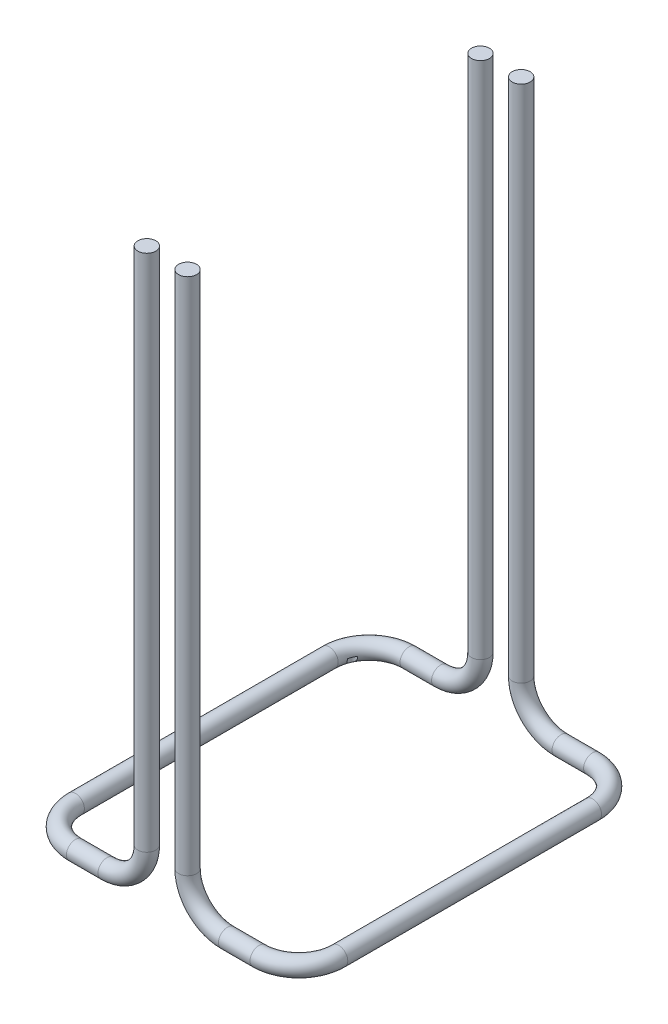
from build123d import *

# Parameters (mm, degrees)
SWEEP_1_PROFILE_R   = 11.25
SWEEP_2_PROFILE_R   = 11.25
SKETCH_35_R         = 5
CUT_EXTRUDE_1_DEPTH = 841.210963366


with BuildPart() as part:
    # 扫描1: sweep along a curve in space
    with BuildLine() as sweep_1_path:
        Line((25.5, 700.453465614, 0), (25.5, 50.453465614, 0))
        ThreePointArc((25.5, 50.453465614, 0), (40.144660941, 15.098126555, 0), (75.5, 0.453465614, 0))
        Line((75.5, 0.453465614, 0), (114.999376874, 0.453465614, 0))
        ThreePointArc((114.999376874, 0.453465614, 0), (150.354715934, 0.453465614, -14.644660941), (164.999376874, 0.453465614, -50))
        Line((164.999376874, 0.453465614, -50), (164.999376874, 0.453465614, -368))
        ThreePointArc((164.999376874, 0.453465614, -368), (150.354715934, 0.453465614, -403.355339059), (114.999376874, 0.453465614, -418))
        Line((114.999376874, 0.453465614, -418), (75.5, 0.453465614, -418))
        ThreePointArc((75.5, 0.453465614, -418), (40.144660941, 15.098126555, -418), (25.5, 50.453465614, -418))
        Line((25.5, 50.453465614, -418), (25.5, 700.453465614, -418))
    # 扫描1 profile (on start of the path) → 扫描1 (sweep)
    with BuildSketch(Plane(origin=(25.5, 700.453465614, 0), x_dir=(0, 0, -1), z_dir=(0, -1, 0))):
        Circle(SWEEP_1_PROFILE_R)
    sweep(path=sweep_1_path.line)


with BuildPart() as body_2:
    # 扫描2: sweep along a curve in space
    with BuildLine() as sweep_2_path:
        Line((-25.5, 50.453465614, -418), (-25.5, 700.453465614, -418))
        ThreePointArc((-25.5, 50.453465614, -418), (-40.144660941, 15.098126555, -418), (-75.5, 0.453465614, -418))
        Line((-114.999376874, 0.453465614, -418), (-75.5, 0.453465614, -418))
        ThreePointArc((-114.999376874, 0.453465614, -418), (-150.354715934, 0.453465614, -403.355339059), (-164.999376874, 0.453465614, -368))
        Line((-164.999376874, 0.453465614, -50), (-164.999376874, 0.453465614, -368))
        ThreePointArc((-164.999376874, 0.453465614, -50), (-150.354715934, 0.453465614, -14.644660941), (-114.999376874, 0.453465614, 0))
        Line((-75.5, 0.453465614, 0), (-114.999376874, 0.453465614, 0))
        ThreePointArc((-75.5, 0.453465614, 0), (-40.144660941, 15.098126555, 0), (-25.5, 50.453465614, 0))
        Line((-25.5, 700.453465614, 0), (-25.5, 50.453465614, 0))
    # 扫描2 profile (on start of the path) → 扫描2 (sweep)
    with BuildSketch(Plane(origin=(-25.5, 700.453465614, 0), x_dir=(0, 0, -1), z_dir=(0, -1, 0))):
        Circle(SWEEP_2_PROFILE_R)
    sweep(path=sweep_2_path.line)


with BuildPart() as cut_extrude_1_tool:
    # 草图35 → 切除-拉伸1 (new, through all)
    with BuildSketch(Plane(origin=(0, 0, 0), x_dir=(1, 0, 0), z_dir=(0, 1, 0))):
        with Locations((-150, 382.5)):
            Circle(SKETCH_35_R)
        with Locations((150, 382.5)):
            Circle(SKETCH_35_R)
        with Locations((150, 17.5)):
            Circle(SKETCH_35_R)
        with Locations((-150, 17.5)):
            Circle(SKETCH_35_R)
    extrude(amount=-CUT_EXTRUDE_1_DEPTH)


with BuildPart() as part_1:
    add(part.part)

    # 切除-拉伸1: cut by cut_extrude_1_tool
    add(cut_extrude_1_tool.part, mode=Mode.SUBTRACT)


with BuildPart() as body_2_1:
    add(body_2.part)

    # 切除-拉伸1: cut by cut_extrude_1_tool
    add(cut_extrude_1_tool.part, mode=Mode.SUBTRACT)


solid = Compound([part_1.part, body_2_1.part])
